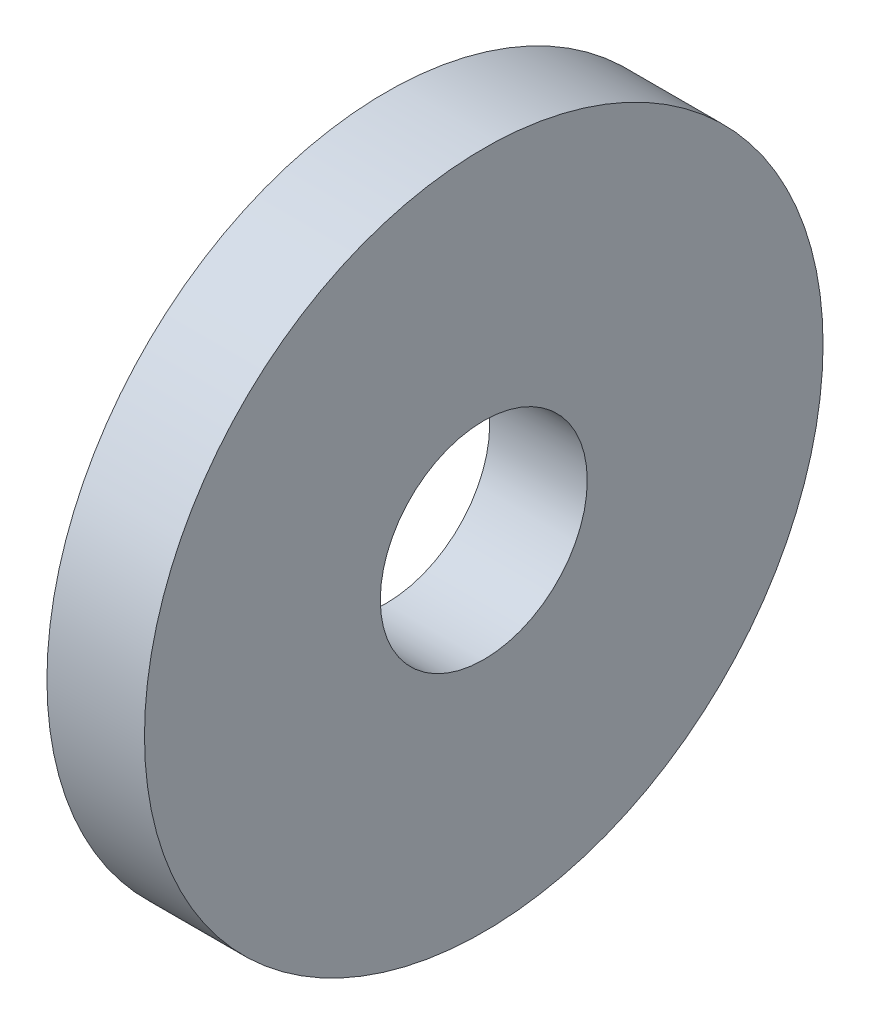
from build123d import *

# Parameters (mm, degrees)
SKETCH1_W = 2.3
SKETCH1_H = 5.56


with BuildPart() as part:
    # Sketch1 → Base-Revolve (revolve)
    with BuildSketch(Plane.XY, mode=Mode.PRIVATE) as base_revolve_sk:
        with Locations((-1.15, 5.22)):
            Rectangle(SKETCH1_W, SKETCH1_H)
    revolve(base_revolve_sk.sketch.rotate(Axis((-34.925, 0, 0), (1, 0, 0)), 90), axis=Axis((-34.925, 0, 0), (1, 0, 0)))


solid = part.part
